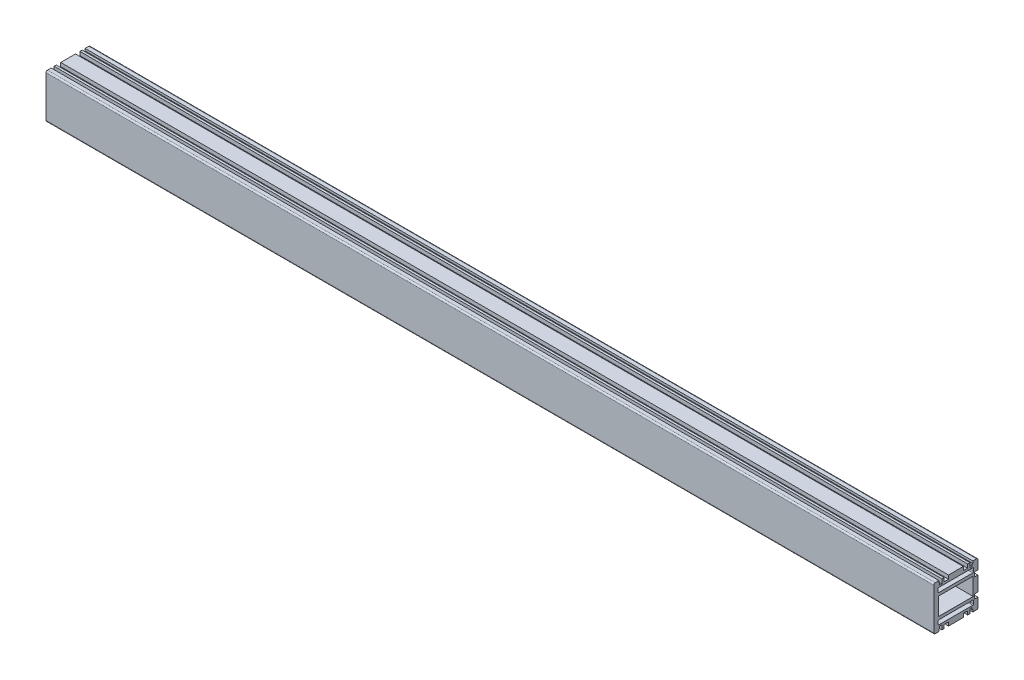
from build123d import *

# Parameters (mm, degrees)
SKETCH_1_W             = 23.5
SKETCH_1_H             = 12
EXTRUDE_1_DEPTH        = 301
HOLE_WIZARD_M6_1_D     = 5
HOLE_WIZARD_M6_1_DEPTH = 15
HOLE_WIZARD_M6_1_TIP   = 1.502151548
HOLE_WIZARD_M6_2_D     = 5
HOLE_WIZARD_M6_2_DEPTH = 15
HOLE_WIZARD_M6_2_TIP   = 1.502151548
HOLE_WIZARD_M4_1_D     = 3.3
HOLE_WIZARD_M4_1_DEPTH = 10.1
HOLE_WIZARD_M4_1_TIP   = 0.991420021


with BuildPart() as part:
    # 草图1 → 凸台-拉伸1 (new, symmetric)
    with BuildSketch(Plane(origin=(0, 0, 0), x_dir=(0, 0, -1), z_dir=(1, 0, 0))):
        with BuildLine():
            Line((-14, 15), (-11.5, 15))
            Line((-11.5, 15), (-11.5, 13.5))
            Line((-11.5, 13.5), (-11.4, 13.5))
            ThreePointArc((-11.4, 13.5), (-11.117157288, 13.382842712), (-11, 13.1))
            Line((-11, 13.1), (-11, 12))
            Line((-11, 12), (-9.5, 12))
            Line((-9.5, 12), (-9.5, 15))
            Line((-9.5, 15), (-8, 15))
            Line((-8, 15), (-8, 12.5))
            Line((-8, 12.5), (-5, 12.5))
            Line((-5, 12.5), (-5, 15))
            Line((-5, 15), (5, 15))
            Line((5, 15), (5, 12.5))
            Line((5, 12.5), (8, 12.5))
            Line((8, 12.5), (8, 15))
            Line((8, 15), (9.5, 15))
            Line((9.5, 15), (9.5, 12))
            Line((9.5, 12), (11, 12))
            Line((11, 12), (11, 13.1))
            ThreePointArc((11, 13.1), (11.117157288, 13.382842712), (11.4, 13.5))
            Line((11.4, 13.5), (11.5, 13.5))
            Line((11.5, 13.5), (11.5, 15))
            Line((11.5, 15), (14, 15))
            ThreePointArc((14, 15), (14.707106781, 14.707106781), (15, 14))
            Line((15, 14), (15, 8))
            Line((15, 8), (12.5, 8))
            Line((12.5, 8), (12.5, 5))
            Line((12.5, 5), (15, 5))
            Line((15, 5), (15, -5))
            Line((15, -5), (12.5, -5))
            Line((12.5, -5), (12.5, -8))
            Line((12.5, -8), (15, -8))
            Line((15, -8), (15, -14))
            ThreePointArc((15, -14), (14.707106781, -14.707106781), (14, -15))
            Line((14, -15), (11.5, -15))
            Line((11.5, -15), (11.5, -13.5))
            Line((11.5, -13.5), (11.4, -13.5))
            ThreePointArc((11.4, -13.5), (11.117157288, -13.382842712), (11, -13.1))
            Line((11, -13.1), (11, -12))
            Line((11, -12), (9.5, -12))
            Line((9.5, -12), (9.5, -15))
            Line((9.5, -15), (8, -15))
            Line((8, -15), (8, -12.5))
            Line((8, -12.5), (5, -12.5))
            Line((5, -12.5), (5, -15))
            Line((5, -15), (-5, -15))
            Line((-5, -15), (-5, -12.5))
            Line((-5, -12.5), (-8, -12.5))
            Line((-8, -12.5), (-8, -15))
            Line((-8, -15), (-9.5, -15))
            Line((-9.5, -15), (-9.5, -12))
            Line((-9.5, -12), (-11, -12))
            Line((-11, -12), (-11, -13.1))
            ThreePointArc((-11, -13.1), (-11.117157288, -13.382842712), (-11.4, -13.5))
            Line((-11.4, -13.5), (-11.5, -13.5))
            Line((-11.5, -13.5), (-11.5, -15))
            Line((-11.5, -15), (-14, -15))
            ThreePointArc((-14, -15), (-14.707106781, -14.707106781), (-15, -14))
            Line((-15, -14), (-15, 14))
            ThreePointArc((-15, 14), (-14.707106781, 14.707106781), (-14, 15))
        make_face()
        with BuildLine():
            Line((12, -10.5), (12, -8.5))
            ThreePointArc((12, -8.5), (11.853553391, -8.146446609), (11.5, -8))
            Line((11.5, -8), (-11.5, -8))
            ThreePointArc((-11.5, -8), (-11.853553391, -8.146446609), (-12, -8.5))
            Line((-12, -8.5), (-12, -10.5))
            ThreePointArc((-12, -10.5), (-11.853553391, -10.853553391), (-11.5, -11))
            Line((-11.5, -11), (11.5, -11))
            ThreePointArc((11.5, -11), (11.853553391, -10.853553391), (12, -10.5))
        make_face(mode=Mode.SUBTRACT)
        with BuildLine():
            Line((-11.5, 11), (11.5, 11))
            ThreePointArc((11.5, 11), (11.853553391, 10.853553391), (12, 10.5))
            Line((12, 10.5), (12, 8.5))
            ThreePointArc((12, 8.5), (11.853553391, 8.146446609), (11.5, 8))
            Line((11.5, 8), (-11.5, 8))
            ThreePointArc((-11.5, 8), (-11.853553391, 8.146446609), (-12, 8.5))
            Line((-12, 8.5), (-12, 10.5))
            ThreePointArc((-12, 10.5), (-11.853553391, 10.853553391), (-11.5, 11))
        make_face(mode=Mode.SUBTRACT)
        Rectangle(SKETCH_1_W, SKETCH_1_H, mode=Mode.SUBTRACT)
    extrude(amount=EXTRUDE_1_DEPTH, both=True)

    # M6 螺纹孔1
    with Locations(Plane.XZ.offset(15)):
        with Locations((281, 0), (266, 0), (-281, 0), (-266, 0)):
            Hole(HOLE_WIZARD_M6_1_D / 2, depth=HOLE_WIZARD_M6_1_DEPTH)
            with Locations((0, 0, -(HOLE_WIZARD_M6_1_DEPTH + HOLE_WIZARD_M6_1_TIP / 2))):  # 118° drill point
                Cone(0, HOLE_WIZARD_M6_1_D / 2, HOLE_WIZARD_M6_1_TIP, mode=Mode.SUBTRACT)

    # M6 螺纹孔2
    with Locations(Plane(origin=(0, 0, -15), x_dir=(-1, 0, 0), z_dir=(0, 0, -1))):
        with Locations((-281, 0), (-266, 0), (14, 0), (29, 0), (99, 0), (114, 0)):
            Hole(HOLE_WIZARD_M6_2_D / 2, depth=HOLE_WIZARD_M6_2_DEPTH)
            with Locations((0, 0, -(HOLE_WIZARD_M6_2_DEPTH + HOLE_WIZARD_M6_2_TIP / 2))):  # 118° drill point
                Cone(0, HOLE_WIZARD_M6_2_D / 2, HOLE_WIZARD_M6_2_TIP, mode=Mode.SUBTRACT)

    # M4 螺纹孔1
    with Locations(Plane(origin=(0, 0, -15), x_dir=(-1, 0, 0), z_dir=(0, 0, -1))):
        with Locations((-226, 0), (-126, 0), (-26, 0)):
            Hole(HOLE_WIZARD_M4_1_D / 2, depth=HOLE_WIZARD_M4_1_DEPTH)
            with Locations((0, 0, -(HOLE_WIZARD_M4_1_DEPTH + HOLE_WIZARD_M4_1_TIP / 2))):  # 118° drill point
                Cone(0, HOLE_WIZARD_M4_1_D / 2, HOLE_WIZARD_M4_1_TIP, mode=Mode.SUBTRACT)


solid = part.part
